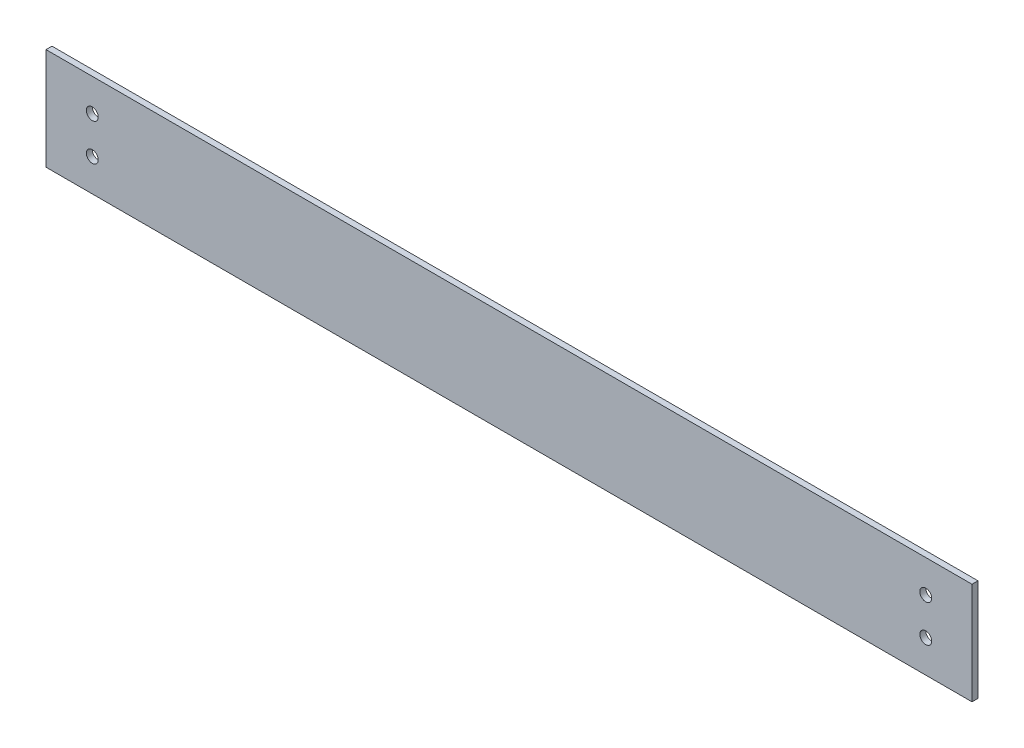
from build123d import *

# Parameters (mm, degrees)
SKETCH1_W           = 254
SKETCH1_H           = 27.94
BOSS_EXTRUDE1_DEPTH = 1.6383
SKETCH2_R           = 1.63195
CUT_EXTRUDE1_DEPTH  = 256.537331181


with BuildPart() as part:
    # Sketch1 → Boss-Extrude1 (new body)
    with BuildSketch(Plane.XY):
        with Locations((127, 13.97)):
            Rectangle(SKETCH1_W, SKETCH1_H)
    extrude(amount=BOSS_EXTRUDE1_DEPTH)

    # Sketch2 → Cut-Extrude1 (cut, through all)
    with BuildSketch(Plane.XY.offset(1.6383)):
        with Locations((12.7, 8.89)):
            Circle(SKETCH2_R)
        with Locations((12.7, 19.05)):
            Circle(SKETCH2_R)
        with Locations((241.3, 8.89)):
            Circle(SKETCH2_R)
        with Locations((241.3, 19.05)):
            Circle(SKETCH2_R)
    extrude(amount=-CUT_EXTRUDE1_DEPTH, mode=Mode.SUBTRACT)


solid = part.part
